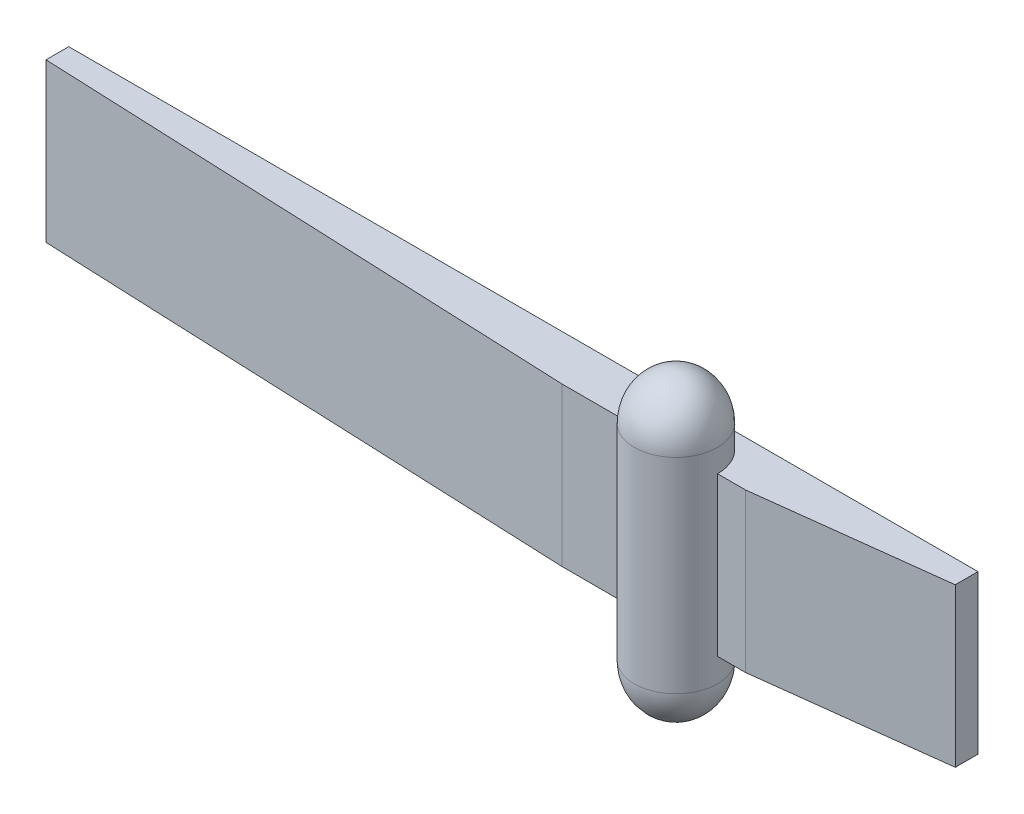
from build123d import *

# Parameters (mm, degrees)
SKETCH1_W                = 199.90213939
SKETCH1_H                = 34.765589459
BOSS_EXTRUDE1_DEPTH      = 10
BOSS_EXTRUDE2_DEPTH      = 5
BOSS_EXTRUDE2_DEPTH_BACK = 40
SKETCH2_R                = 9.143615086
DOME1_FACE_RADIUS        = 9.143615086
DOME1_HEIGHT             = 10
DOME2_FACE_RADIUS        = 9.143615086
DOME2_HEIGHT             = 10
CUT_EXTRUDE1_DEPTH       = 54


with BuildPart() as part:
    # Sketch1 → Boss-Extrude1 (new body)
    with BuildSketch(Plane.XY):
        with Locations((43.456986824, -5.3114095)):
            Rectangle(SKETCH1_W, SKETCH1_H)
    extrude(amount=BOSS_EXTRUDE1_DEPTH)

    # Sketch2 → Boss-Extrude2 (add, two sides: drawn at the far end of the back side and taken through both)
    with BuildSketch(Plane(origin=(0, 12.071385229, 0), x_dir=(1, 0, 0), z_dir=(0, 1, 0)).offset(-BOSS_EXTRUDE2_DEPTH_BACK)):
        with Locations((86.99978083, -10)):
            Circle(SKETCH2_R)
    extrude(amount=BOSS_EXTRUDE2_DEPTH + BOSS_EXTRUDE2_DEPTH_BACK)

    # Dome1: an elliptical dome of height H over a round flat face of radius A is half a spheroid: the quarter ellipse of half axes A and H revolved about the face's axis
    with BuildSketch(Plane((86.99978083, 17.071385229, 10), x_dir=(0, 0, -1), z_dir=(1, 0, 0)), mode=Mode.PRIVATE) as dome1_quarter:
        Ellipse(DOME1_FACE_RADIUS, DOME1_HEIGHT)
        Rectangle(DOME1_FACE_RADIUS, DOME1_HEIGHT, align=(Align.MIN, Align.MIN), mode=Mode.INTERSECT)
    revolve(dome1_quarter.sketch, axis=Axis((86.99978083, 17.071385229, 10), (0, 1, 0)))

    # Dome2: an elliptical dome of height H over a round flat face of radius A is half a spheroid: the quarter ellipse of half axes A and H revolved about the face's axis
    with BuildSketch(Plane((86.99978083, -27.928614771, 10), x_dir=(0, 0, 1), z_dir=(1, 0, 0)), mode=Mode.PRIVATE) as dome2_quarter:
        Ellipse(DOME2_FACE_RADIUS, DOME2_HEIGHT)
        Rectangle(DOME2_FACE_RADIUS, DOME2_HEIGHT, align=(Align.MIN, Align.MIN), mode=Mode.INTERSECT)
    revolve(dome2_quarter.sketch, axis=Axis((86.99978083, -27.928614771, 10), (0, -1, 0)))

    # Sketch3 → Cut-Extrude1 (cut)
    with BuildSketch(Plane(origin=(0, 12.071385229, 0), x_dir=(1, 0, 0), z_dir=(0, 1, 0))):
        Polygon((-56.494082871, -5), (61.988701151, -10), (-56.494082871, -10), align=None)
        Polygon((143.408056519, -5), (102.312904095, -10), (143.408056519, -10), align=None)
    extrude(amount=-CUT_EXTRUDE1_DEPTH, mode=Mode.SUBTRACT)


solid = part.part
